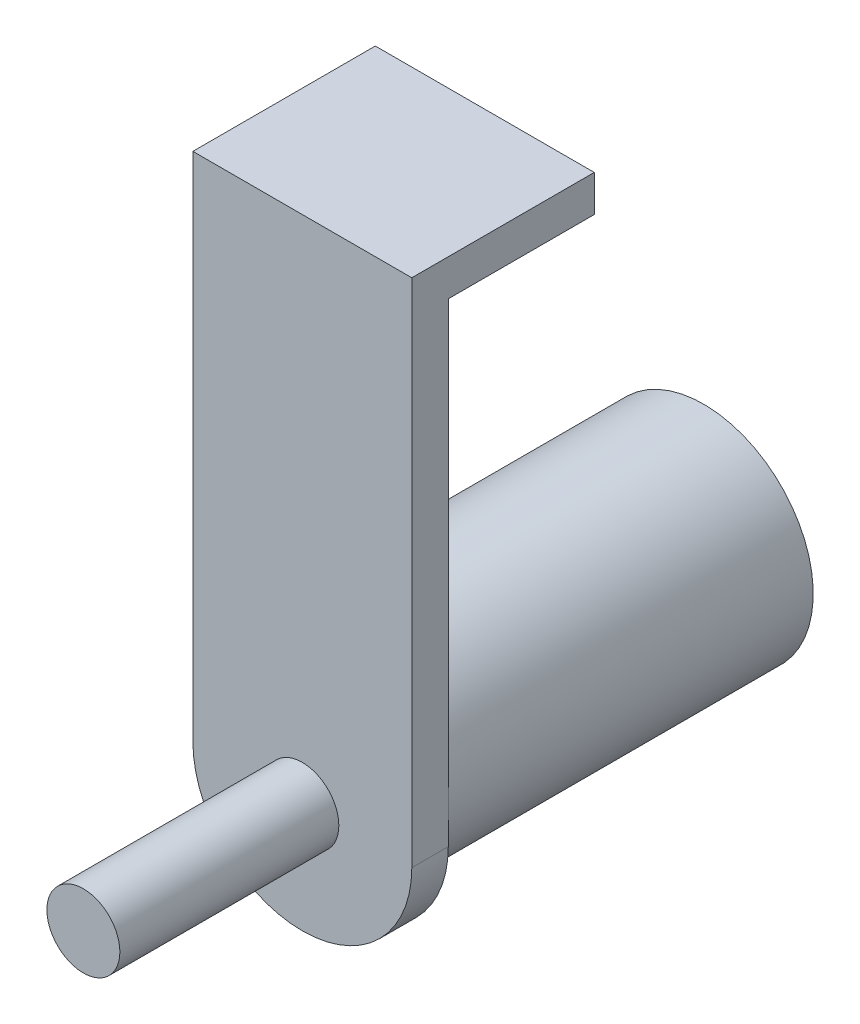
from build123d import *

# Parameters (mm, degrees)
ESQUISSE1_R             = 0.76020263
BOSS_EXTRU_1_DEPTH      = 5
ESQUISSE2_W             = 30
ESQUISSE2_H             = 5
BOSS_EXTRU_2_DEPTH      = 20
ESQUISSE4_R             = 5
BOSS_EXTRU_3_DEPTH      = 15
ESQUISSE5_R             = 15
BOSS_EXTRU_4_DEPTH      = 50
ESQUISSE8_W             = 0.1
ESQUISSE8_H             = 0.1
ENL_V_MAT_EXTRU_1_DEPTH = 15
ESQUISSE7_R             = 5
BOSS_EXTRU_6_DEPTH      = 15


with BuildPart() as part:
    # Esquisse1 → Boss.-Extru.1 (new body)
    with BuildSketch(Plane.XY):
        with BuildLine():
            Line((-15, 35), (15, 35))
            Line((15, 35), (15, -34.999999772))
            ThreePointArc((15, -34.999999772), (1.14e-07, -49.999999886), (-15, -35))
            Line((-15, -35), (-15, 35))
        make_face()
        with Locations((0, -34.999999886)):
            Circle(ESQUISSE1_R, mode=Mode.SUBTRACT)
    extrude(amount=BOSS_EXTRU_1_DEPTH)

    # Esquisse2 → Boss.-Extru.2 (add)
    with BuildSketch(Plane(origin=(0, 0, 0), x_dir=(-1, 0, 0), z_dir=(0, 0, -1))):
        with Locations((0, 32.5)):
            Rectangle(ESQUISSE2_W, ESQUISSE2_H)
    extrude(amount=BOSS_EXTRU_2_DEPTH)

    # Esquisse4 → Boss.-Extru.3 (add)
    with BuildSketch(Plane.XY.offset(5)):
        with Locations((0, -34.999999886)):
            Circle(ESQUISSE4_R)
    extrude(amount=BOSS_EXTRU_3_DEPTH)

    # Esquisse5 → Boss.-Extru.4 (add)
    with BuildSketch(Plane(origin=(0, 0, 0), x_dir=(-1, 0, 0), z_dir=(0, 0, -1))):
        with Locations((0, -30)):
            Circle(ESQUISSE5_R)
    extrude(amount=BOSS_EXTRU_4_DEPTH)

    # Esquisse8 → Enlèv. mat.-Extru.1 (cut)
    with BuildSketch(Plane.XY.offset(20)):
        with Locations((0, -34.999999886)):
            Rectangle(ESQUISSE8_W, ESQUISSE8_H)
    extrude(amount=-ENL_V_MAT_EXTRU_1_DEPTH, mode=Mode.SUBTRACT)

    # Esquisse7 → Boss.-Extru.6 (add)
    with BuildSketch(Plane.XY.offset(20)):
        with Locations((0, -34.999999886)):
            Circle(ESQUISSE7_R)
    extrude(amount=BOSS_EXTRU_6_DEPTH)


solid = part.part
